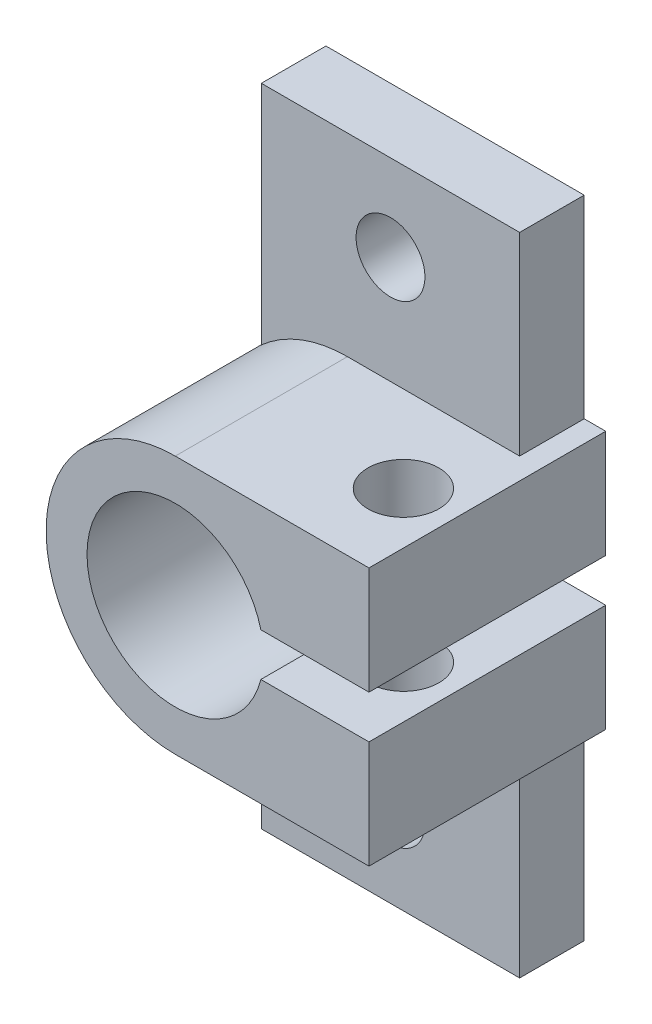
from build123d import *

# Parameters (mm, degrees)
ESBO_O1_R                     = 1.6
RESSALTO_EXTRUS_O1_DEPTH      = 3
RESSALTO_EXTRUS_O1_2_DEPTH    = 3
RESSALTO_EXTRUS_O2_DEPTH      = 8
RESSALTO_EXTRUS_O2_DEPTH_BACK = 3
CORTE_EXTRUS_O1_DEPTH         = 26.357444666
CORTE_EXTRUS_O1_DEPTH_BACK    = 26.357444666
ESBO_O3_R                     = 1.65


with BuildPart() as part:
    # Esboço1 → Ressalto-extrusão1 (new body)
    with BuildSketch(Plane.XY):
        with BuildLine():
            ThreePointArc((-4, -0.9), (-0.051399019, -4.099677809), (3.97617907, -1))
            Line((3.97617907, -1), (8, -1))
            Line((8, -1), (8, -15))
            Line((8, -15), (-4, -15))
            Line((-4, -15), (-4, -0.9))
        make_face()
        with Locations((2, -11)):
            Circle(ESBO_O1_R, mode=Mode.SUBTRACT)
    extrude(amount=RESSALTO_EXTRUS_O1_DEPTH)



with BuildPart() as body_2:
    # Esboço1 → Ressalto-extrus_o1 2 (new body)
    with BuildSketch(Plane.XY):
        with BuildLine():
            ThreePointArc((3.97617907, 1), (-0.051399019, 4.099677809), (-4, 0.9))
            Line((-4, 0.9), (-4, 15))
            Line((-4, 15), (8, 15))
            Line((8, 15), (8, 1))
            Line((8, 1), (3.97617907, 1))
        make_face()
        with Locations((2, 11)):
            Circle(ESBO_O1_R, mode=Mode.SUBTRACT)
    extrude(amount=RESSALTO_EXTRUS_O1_2_DEPTH)


with BuildPart() as part_1:
    add(part.part)

    add(body_2.part)  # Ressalto-extrusão2 merges body 2
    # Esboço2 → Ressalto-extrusão2 (add, two sides: drawn at the far end of the back side and taken through both)
    with BuildSketch(Plane.XY.offset(3).offset(-RESSALTO_EXTRUS_O2_DEPTH_BACK)):
        with BuildLine():
            Line((9, 6), (9, 1))
            Line((9, 1), (3.97617907, 1))
            ThreePointArc((3.97617907, 1), (-4.1, 0), (3.97617907, -1))
            Line((3.97617907, -1), (9, -1))
            Line((9, -1), (9, -6))
            Line((9, -6), (0, -6))
            ThreePointArc((0, -6), (-6, 0), (0, 6))
            Line((0, 6), (9, 6))
        make_face()
    extrude(amount=RESSALTO_EXTRUS_O2_DEPTH + RESSALTO_EXTRUS_O2_DEPTH_BACK)

    # Esboço3 → Corte-extrusão1 (cut, two sides: drawn at the far end of the back side and taken through both)
    with BuildSketch(Plane.XZ.offset(-6).offset(-CORTE_EXTRUS_O1_DEPTH_BACK)):
        with Locations(Location((6.6, 7, 0), (0, 0, 270))):
            Circle(ESBO_O3_R)
    extrude(amount=CORTE_EXTRUS_O1_DEPTH + CORTE_EXTRUS_O1_DEPTH_BACK, mode=Mode.SUBTRACT)


solid = part_1.part
